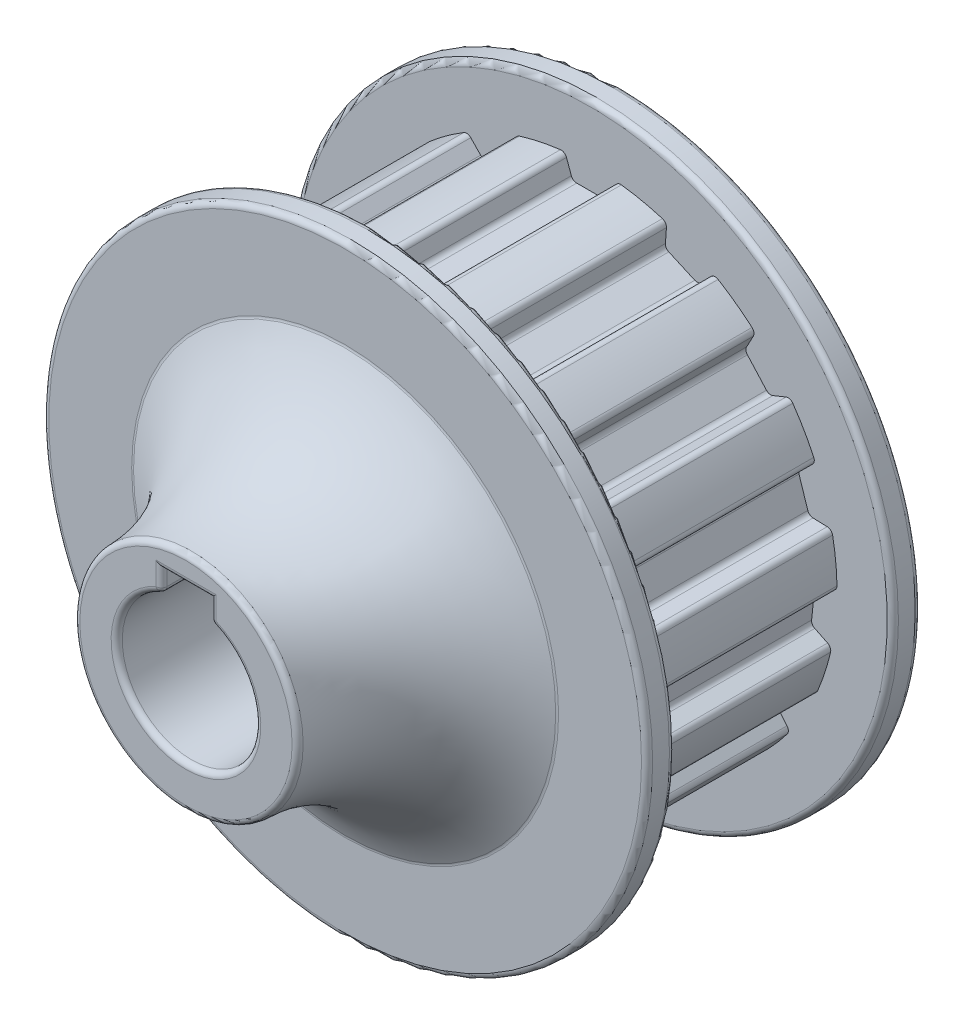
from build123d import *

# Parameters (mm, degrees)
BOSS_EXTRUDE1_DEPTH      = 7.25
BOSS_EXTRUDE1_DEPTH_BACK = 7.25
SKETCH7_R                = 22.031647778
CUT_EXTRUDE3_DEPTH       = 38.855475266
CUT_EXTRUDE3_DEPTH_BACK  = 38.855475266
SKETCH15_R               = 8.008120878
SKETCH15_R_2             = 2.25
BOSS_EXTRUDE2_DEPTH      = 5.5
SKETCH16_R               = 5
CUT_EXTRUDE4_DEPTH       = 3
BOSS_EXTRUDE3_START      = 7.5
SKETCH17_R               = 22.031647778
SKETCH17_R_2             = 5
BOSS_EXTRUDE3_DEPTH      = 7.5
CUT_EXTRUDE2_DEPTH       = 38.855475266
CUT_EXTRUDE2_DEPTH_BACK  = 38.855475266
FILLET2_R                = 0.51
BOSS_EXTRUDE4_START      = 2.5
SKETCH18_R               = 27.031647778
SKETCH18_R_2             = 5
BOSS_EXTRUDE4_DEPTH      = 2.5
BOSS_EXTRUDE5_START      = -2.5
SKETCH19_R               = 27.031647778
SKETCH19_R_2             = 19
BOSS_EXTRUDE5_DEPTH      = 2.5
FILLET3_R                = 0.5


with BuildPart() as part:
    # Sketch7 → Boss-Extrude1 (new, two sides: drawn at the far end of the back side and taken through both)
    with BuildSketch(Plane.XY.offset(-BOSS_EXTRUDE1_DEPTH_BACK)):
        Circle(SKETCH7_R)
    extrude(amount=BOSS_EXTRUDE1_DEPTH + BOSS_EXTRUDE1_DEPTH_BACK)

    # Sketch14 → Revolve1 (revolve)
    with BuildSketch(Plane(origin=(0, 0, 0), x_dir=(0, 0, -1), z_dir=(1, 0, 0))):
        with BuildLine():
            Line((-21.5, 0), (0, 0))
            Line((0, 0), (0, 19))
            Line((0, 19), (-7.25, 19))
            ThreePointArc((-7.25, 19), (-13.040017522, 12.386277742), (-21.5, 10))
            Line((-21.5, 10), (-21.5, 0))
        make_face()
    revolve(axis=Axis((0, 0, -36.129595921), (0, 0, 1)))

    # Sketch10 → Cut-Extrude3 (cut, two sides: drawn at the far end of the back side and taken through both)
    with BuildSketch(Plane.XY.offset(-CUT_EXTRUDE3_DEPTH_BACK)):
        with BuildLine():
            Line((2.2, 7.7), (-2.2, 7.7))
            Line((-2.2, 7.7), (-2.2, 5.796550698))
            ThreePointArc((-2.2, 5.796550698), (0, -6.2), (2.2, 5.796550698))
            Line((2.2, 5.796550698), (2.2, 7.7))
        make_face()
    extrude(amount=CUT_EXTRUDE3_DEPTH + CUT_EXTRUDE3_DEPTH_BACK, mode=Mode.SUBTRACT)

    # Sketch15 → Boss-Extrude2 (add)
    with BuildSketch(Plane(origin=(0, 0, -7.25), x_dir=(-1, 0, 0), z_dir=(0, 0, -1))):
        Circle(SKETCH15_R)
        Circle(SKETCH15_R_2, mode=Mode.SUBTRACT)
    extrude(amount=-BOSS_EXTRUDE2_DEPTH)

    # Sketch16 → Cut-Extrude4 (cut)
    with BuildSketch(Plane(origin=(0, 0, -7.25), x_dir=(-1, 0, 0), z_dir=(0, 0, -1))):
        Circle(SKETCH16_R)
    extrude(amount=-CUT_EXTRUDE4_DEPTH, mode=Mode.SUBTRACT)

    # Sketch17 → Boss-Extrude3 (add)
    with BuildSketch(Plane(origin=(0, 0, -7.25), x_dir=(-1, 0, 0), z_dir=(0, 0, -1)).offset(BOSS_EXTRUDE3_START)):
        Circle(SKETCH17_R)
        Circle(SKETCH17_R_2, mode=Mode.SUBTRACT)
    extrude(amount=-BOSS_EXTRUDE3_DEPTH)

    # Sketch8 → Cut-Extrude2 (cut, two sides: drawn at the far end of the back side and taken through both)
    with BuildSketch(Plane.XY.offset(-CUT_EXTRUDE2_DEPTH_BACK)):
        Polygon((-1.629816853, 19.998625671), (-2.369776385, 22.031647778), (2.369776385, 22.031647778), (1.629816853, 19.998625671), align=None)
        Polygon((6.645262089, 18.932559877), (6.796180007, 21.090786644), (11.125976911, 19.16303686), (9.623085654, 17.606747406), align=None)
        Polygon((13.771314846, 14.592882482), (14.787015134, 16.503136895), (17.958394952, 12.980962779), (15.952435523, 12.170502561), align=None)
        Polygon((18.516182157, 7.729963135), (20.221041008, 9.061944851), (21.68564336, 4.554362304), (19.523464367, 4.629867259), align=None)
        Polygon((20.059433359, -0.469537064), (22.15866519, 0.053860216), (21.663247022, -4.659728787), (19.718708857, -3.711314154), align=None)
        Polygon((18.134226299, -8.587850038), (20.264854855, -8.963537338), (17.89507847, -13.06811044), (16.504409446, -11.410775634), align=None)
        Polygon((13.073446767, -15.221245722), (14.867067016, -16.431057856), (11.032688279, -19.216897077), (10.436347704, -17.137210342), align=None)
        Polygon((5.752149521, -19.222749741), (6.898628226, -21.057499199), (2.262646056, -22.042907629), (2.563746633, -19.900465696), align=None)
        Polygon((-2.563746633, -19.900465696), (-2.262646056, -22.042907629), (-6.898628226, -21.057499199), (-5.752149521, -19.222749741), align=None)
        Polygon((-10.436347704, -17.137210342), (-11.032688279, -19.216897077), (-14.867067016, -16.431057856), (-13.073446767, -15.221245722), align=None)
        Polygon((-16.504409446, -11.410775634), (-17.89507847, -13.06811044), (-20.264854855, -8.963537338), (-18.134226299, -8.587850038), align=None)
        Polygon((-19.718708857, -3.711314154), (-21.663247022, -4.659728787), (-22.15866519, 0.053860216), (-20.059433359, -0.469537064), align=None)
        Polygon((-19.523464367, 4.629867259), (-21.68564336, 4.554362304), (-20.221041008, 9.061944851), (-18.516182157, 7.729963135), align=None)
        Polygon((-15.952435523, 12.170502561), (-17.958394952, 12.980962779), (-14.787015134, 16.503136895), (-13.771314846, 14.592882482), align=None)
        Polygon((-9.623085654, 17.606747406), (-11.125976911, 19.16303686), (-6.796180007, 21.090786644), (-6.645262089, 18.932559877), align=None)
    extrude(amount=CUT_EXTRUDE2_DEPTH + CUT_EXTRUDE2_DEPTH_BACK, mode=Mode.SUBTRACT)

    # Fillet2
    fillet2_edges = [part.edges().sort_by_distance(p)[0] for p in [
        (-6.787047671, 20.960188161, -3.75),
        (-11.035034049, 19.06886277, -3.75),
        (-14.725553141, 16.387543699, -3.75),
        (-17.837010461, 12.931920261, -3.75),
        (-20.117876696, 8.981344056, -3.75),
        (-21.55480572, 4.558931255, -3.75),
        (-22.031636605, 0.022188433, -3.75),
        (-21.545579251, -4.60233838, -3.75),
        (-20.135926394, -8.940803772, -3.75),
        (-17.810926394, -12.9678219, -3.75),
        (-14.75853158, -16.35784978, -3.75),
        (-10.996602556, -19.091051203, -3.75),
        (-6.829252579, -20.946474955, -3.75),
        (-2.280866235, -21.913264317, -3.75),
        (2.280866235, -21.913264317, -3.75),
        (6.829252579, -20.946474955, -3.75),
        (10.996602556, -19.091051203, -3.75),
        (14.75853158, -16.35784978, -3.75),
        (17.810926394, -12.9678219, -3.75),
        (20.135926394, -8.940803772, -3.75),
        (21.545579251, -4.60233838, -3.75),
        (22.031636605, 0.022188433, -3.75),
        (21.55480572, 4.558931255, -3.75),
        (20.117876696, 8.981344056, -3.75),
        (17.837010461, 12.931920261, -3.75),
        (14.725553141, 16.387543699, -3.75),
        (11.035034049, 19.06886277, -3.75),
        (6.787047671, 20.960188161, -3.75),
        (2.325, 21.908625671, -3.75),
        (-6.645262089, 18.932559877, -3.75),
        (-9.623085654, 17.606747406, -3.75),
        (-13.771314846, 14.592882482, -3.75),
        (-15.952435523, 12.170502561, -3.75),
        (-18.516182157, 7.729963135, -3.75),
        (-19.523464367, 4.629867259, -3.75),
        (-20.059433359, -0.469537064, -3.75),
        (-19.718708857, -3.711314154, -3.75),
        (-18.134226299, -8.587850038, -3.75),
        (-16.504409446, -11.410775634, -3.75),
        (-13.073446767, -15.221245722, -3.75),
        (-10.436347704, -17.137210342, -3.75),
        (-5.752149521, -19.222749741, -3.75),
        (-2.563746633, -19.900465696, -3.75),
        (2.563746633, -19.900465696, -3.75),
        (5.752149521, -19.222749741, -3.75),
        (10.436347704, -17.137210342, -3.75),
        (13.073446767, -15.221245722, -3.75),
        (16.504409446, -11.410775634, -3.75),
        (18.134226299, -8.587850038, -3.75),
        (19.718708857, -3.711314154, -3.75),
        (20.059433359, -0.469537064, -3.75),
        (19.523464367, 4.629867259, -3.75),
        (18.516182157, 7.729963135, -3.75),
        (15.952435523, 12.170502561, -3.75),
        (13.771314846, 14.592882482, -3.75),
        (9.623085654, 17.606747406, -3.75),
        (6.645262089, 18.932559877, -3.75),
        (1.629816853, 19.998625671, -3.75),
        (-1.629816853, 19.998625671, -3.75),
        (-2.325, 21.908625671, -3.75),
    ]]
    fillet(fillet2_edges, radius=FILLET2_R)

    # Sketch18 → Boss-Extrude4 (add)
    with BuildSketch(Plane(origin=(0, 0, -14.75), x_dir=(-1, 0, 0), z_dir=(0, 0, -1)).offset(BOSS_EXTRUDE4_START)):
        Circle(SKETCH18_R)
        Circle(SKETCH18_R_2, mode=Mode.SUBTRACT)
    extrude(amount=-BOSS_EXTRUDE4_DEPTH)

    # Sketch19 → Boss-Extrude5 (add)
    with BuildSketch(Plane.XY.offset(7.25).offset(BOSS_EXTRUDE5_START)):
        Circle(SKETCH19_R)
        Circle(SKETCH19_R_2, mode=Mode.SUBTRACT)
    extrude(amount=BOSS_EXTRUDE5_DEPTH)

    # Fillet3
    fillet3_edges = [part.edges().sort_by_distance(p)[0] for p in [
        (2.2, 5.796550698, 9.875),
        (-2.2, 5.796550698, 9.875),
        (2.2, 6.748275349, 21.5),
        (-2.2, 6.748275349, 21.5),
        (0, 7.7, 21.5),
        (0, -19, 7.25),
        (0, -10, 21.5),
        (0, -6.2, 21.5),
        (5, 0, -4.25),
        (2.25, 0, -4.25),
        (-2.2, 6.748275349, -1.75),
        (2.2, 6.748275349, -1.75),
        (-27.031647778, 0, 4.75),
        (27.031647778, 0, -14.75),
        (27.031647778, 0, -17.25),
        (-27.031647778, 0, 7.25),
        (0, 7.7, -1.75),
        (0, -6.2, -1.75),
        (5, 0, -17.25),
    ]]
    fillet(fillet3_edges, radius=FILLET3_R)


solid = part.part
